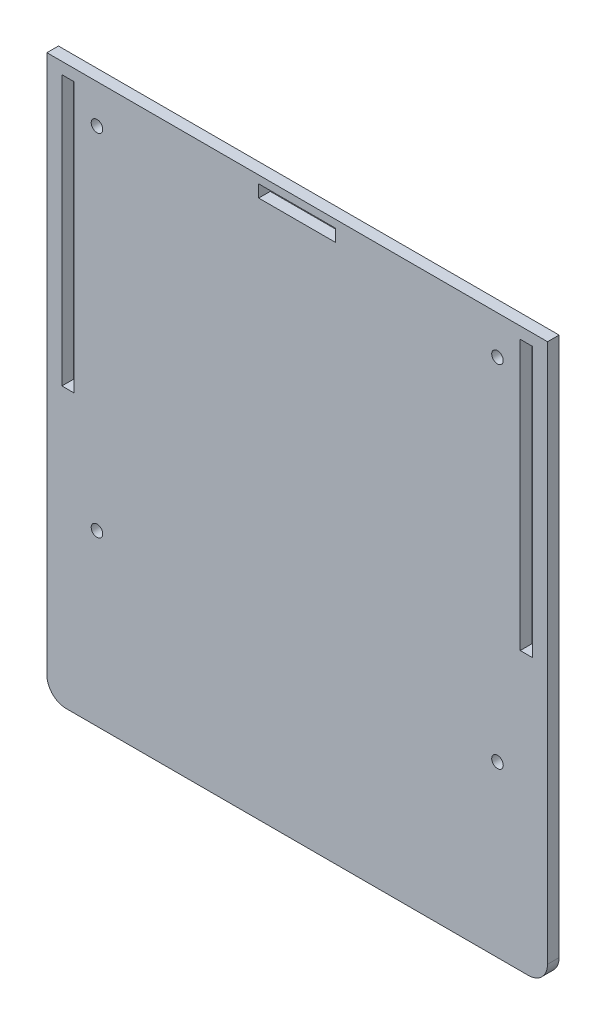
from build123d import *

# Parameters (mm, degrees)
SKETCH1_R           = 1.5
SKETCH1_W           = 20
SKETCH1_H           = 3.2
SKETCH1_W_2         = 3.2
SKETCH1_H_2         = 70
BOSS_EXTRUDE1_DEPTH = 3


with BuildPart() as part:
    # Sketch1 → Boss-Extrude1 (new body)
    with BuildSketch(Plane.XY):
        with BuildLine():
            Line((-60, -75), (60, -75))
            ThreePointArc((60, -75), (63.535533906, -73.535533906), (65, -70))
            Line((65, -70), (65, 70))
            Line((65, 70), (-65, 70))
            Line((-65, 70), (-65, -70))
            ThreePointArc((-65, -70), (-63.535533906, -73.535533906), (-60, -75))
        make_face()
        with Locations((-52, -31)):
            Circle(SKETCH1_R, mode=Mode.SUBTRACT)
        with Locations((52, -31)):
            Circle(SKETCH1_R, mode=Mode.SUBTRACT)
        with Locations((52, 60)):
            Circle(SKETCH1_R, mode=Mode.SUBTRACT)
        with Locations((-52, 60)):
            Circle(SKETCH1_R, mode=Mode.SUBTRACT)
        with Locations((0, 66.4)):
            Rectangle(SKETCH1_W, SKETCH1_H, mode=Mode.SUBTRACT)
        with Locations((-59.5, 32)):
            Rectangle(SKETCH1_W_2, SKETCH1_H_2, mode=Mode.SUBTRACT)
        with Locations((59.5, 32)):
            Rectangle(SKETCH1_W_2, SKETCH1_H_2, mode=Mode.SUBTRACT)
    extrude(amount=BOSS_EXTRUDE1_DEPTH)


solid = part.part
